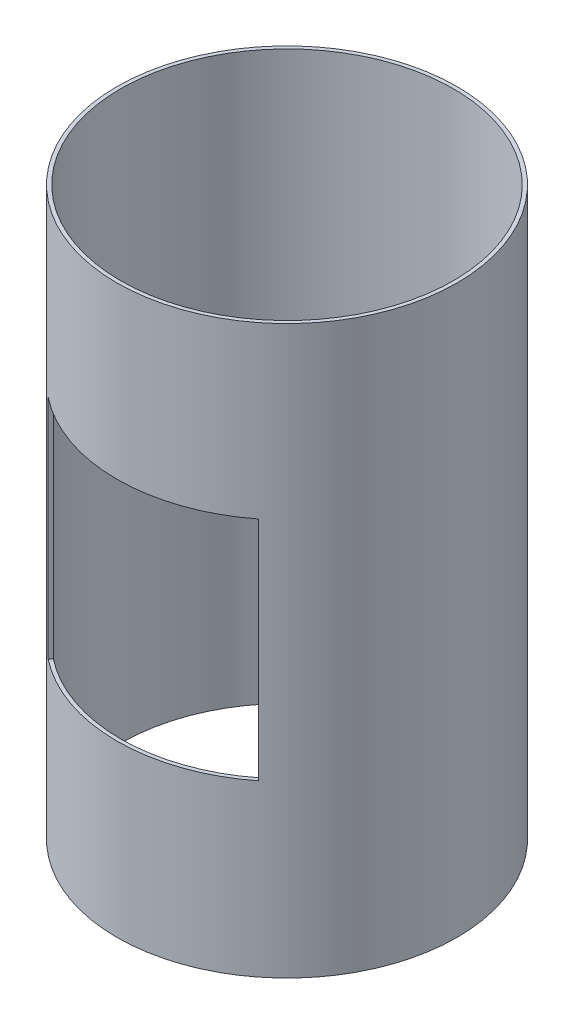
from build123d import *

# Parameters (mm, degrees)
SKETCH1_R           = 76.2
SKETCH1_R_2         = 74.549
BOSS_EXTRUDE1_DEPTH = 254
WRAP2_SECTION_W     = 3.302
WRAP2_SECTION_H     = 101.6
WRAP2_ANGLE         = 76.394372684


with BuildPart() as part:
    # Sketch1 → Boss-Extrude1 (new body)
    with BuildSketch(Plane(origin=(0, 0, 0), x_dir=(1, 0, 0), z_dir=(0, 1, 0))):
        with Locations(Location((0, 0, 0), (0, 0, 270))):
            Circle(SKETCH1_R)
        with Locations(Location((0, 0, 0), (0, 0, 270))):
            Circle(SKETCH1_R_2, mode=Mode.SUBTRACT)
    extrude(amount=BOSS_EXTRUDE1_DEPTH)

    # Wrap2 section (on wrap section) → Wrap2 (revolve, cut)
    with BuildSketch(Plane(origin=(0, 0, 0), x_dir=(0.6183698030697371, 0, 0.7858872607769479), z_dir=(0.7858872607769479, 0, -0.6183698030697371))):
        with Locations((74.549, -127)):
            Rectangle(WRAP2_SECTION_W, WRAP2_SECTION_H)
    revolve(axis=Axis((0, 0, 0), (0, -1, 0)), revolution_arc=WRAP2_ANGLE, mode=Mode.SUBTRACT)


solid = part.part
